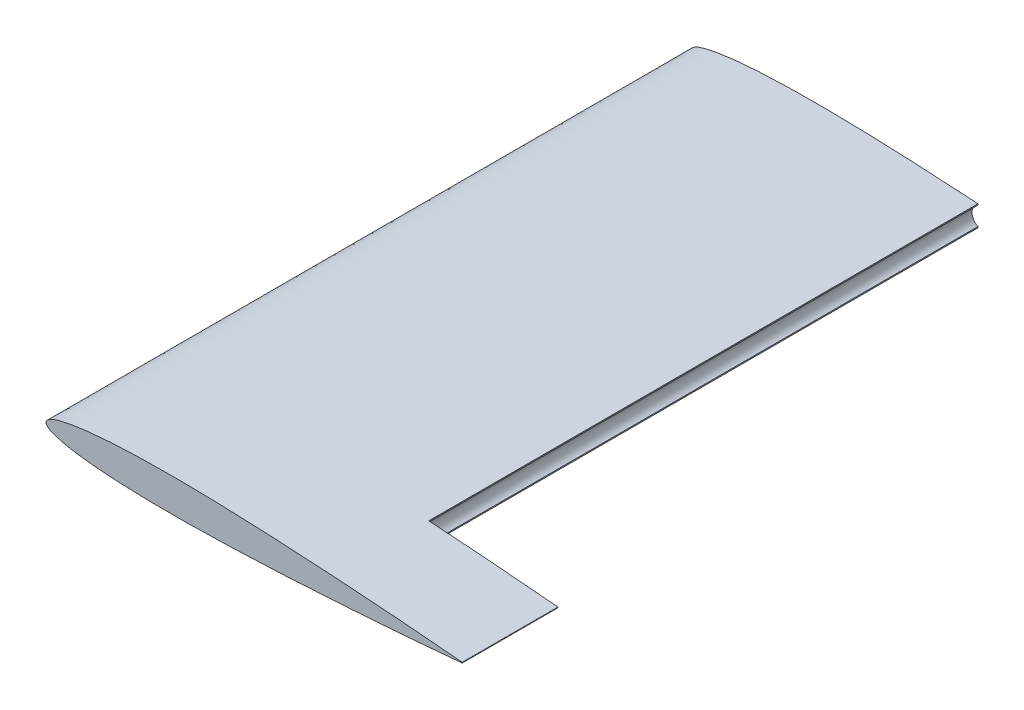
from build123d import *

# Parameters (mm, degrees)
CORPOFOAM_DEPTH             = 132
FOAMLATERALE_DEPTH          = 23
SCHIZZO2_R                  = 3
FOROLONGHERONE_DEPTH        = 185.547595795
SCHIZZO6_W                  = 3
SCHIZZO6_H                  = 5.01489576
SMUSSOPOSTERIORE_DEPTH      = 132
SCHIZZO8_R                  = 1.5
FOROPERNO_DEPTH             = 185.547595795
SCHIZZO9_R                  = 3
SCHIZZO9_R_2                = 1.5
CHIUSURAFORITERMINALI_DEPTH = 5
SCHIZZO10_R                 = 1.75
FOROVITE_DEPTH              = 13
TAGLIODADO_DEPTH            = 3


with BuildPart() as part:
    # Schizzo1 → CorpoFoam (new body)
    with BuildSketch(Plane.XY):
        with BuildLine():
            ThreePointArc((70, -2.443), (67.557, 0), (70, 2.443))
            add(Edge.make_bspline(
                [(70, 2.443), (66.667669045, 2.659279734), (60.003104625, 3.061747723), (50.003008601, 3.552139212), (40.002598558, 3.902946494), (31.666961486, 4.025260151), (24.9991546, 3.976933791), (19.997775587, 3.844976398), (14.993363131, 3.592486959), (10.827184065, 3.237651579), (7.489054388, 2.814021367), (4.99359465, 2.403673059), (2.84962634, 1.867925494), (1.165413503, 1.320987252), (-0.664613784, 0), (1.165413503, -1.320987252), (2.84962634, -1.867925494), (4.99359465, -2.403673059), (7.489054388, -2.814021367), (10.827184065, -3.237651579), (14.993363131, -3.592486959), (19.997775587, -3.844976398), (24.9991546, -3.976933791), (31.666961486, -4.025260151), (40.002598558, -3.902946494), (50.003008601, -3.552139212), (60.003104625, -3.061747723), (66.667669045, -2.659279734), (70, -2.443)],
                knots=[0.149112224, 0.149112224, 0.149112224, 0.149112224, 0.198750974, 0.248359097, 0.29793737, 0.347491327, 0.37226694, 0.397050924, 0.421859475, 0.446731346, 0.459220451, 0.471790602, 0.484560454, 0.491195112, 0.5, 0.508804888, 0.515439546, 0.528209398, 0.540779549, 0.553268654, 0.578140525, 0.602949076, 0.62773306, 0.652508673, 0.70206263, 0.751640903, 0.801249026, 0.850887776, 0.850887776, 0.850887776, 0.850887776], degree=3))
        make_face()
    extrude(amount=CORPOFOAM_DEPTH)

    # Schizzo7 → FoamLaterale (add)
    with BuildSketch(Plane.XY.offset(132)):
        with BuildLine():
            ThreePointArc((100, 0.084), (100.084, 0), (100, -0.084))
            add(Edge.make_bspline(
                [(100, 0.084), (98.333488815, 0.23674648), (95.001194725, 0.542172689), (88.335559621, 1.11089898), (80.003293356, 1.763610995), (70.002998933, 2.457861693), (60.003104625, 3.061747723), (50.003008601, 3.552139212), (40.002598558, 3.902946494), (31.666961486, 4.025260151), (24.9991546, 3.976933791), (19.997775587, 3.844976398), (14.993363131, 3.592486959), (10.827184065, 3.237651579), (7.489054388, 2.814021367), (4.99359465, 2.403673059), (2.84962634, 1.867925494), (1.165413503, 1.320987252), (-0.664613784, 0), (1.165413503, -1.320987252), (2.84962634, -1.867925494), (4.99359465, -2.403673059), (7.489054388, -2.814021367), (10.827184065, -3.237651579), (14.993363131, -3.592486959), (19.997775587, -3.844976398), (24.9991546, -3.976933791), (31.666961486, -4.025260151), (40.002598558, -3.902946494), (50.003008601, -3.552139212), (60.003104625, -3.061747723), (70.002998933, -2.457861693), (80.003293356, -1.763610995), (88.335559621, -1.11089898), (95.001194725, -0.542172689), (98.333488815, -0.23674648), (100, -0.084)],
                knots=[0, 0, 0, 0, 0.024876293, 0.049741715, 0.099443402, 0.149112224, 0.198750974, 0.248359097, 0.29793737, 0.347491327, 0.37226694, 0.397050924, 0.421859475, 0.446731346, 0.459220451, 0.471790602, 0.484560454, 0.491195112, 0.5, 0.508804888, 0.515439546, 0.528209398, 0.540779549, 0.553268654, 0.578140525, 0.602949076, 0.62773306, 0.652508673, 0.70206263, 0.751640903, 0.801249026, 0.850887776, 0.900556598, 0.950258285, 0.975123707, 1, 1, 1, 1], degree=3))
        make_face()
    extrude(amount=FOAMLATERALE_DEPTH)

    # Schizzo2 → ForoLongherone (cut, through all)
    with BuildSketch(Plane.XY.offset(155)):
        with Locations((25, 0)):
            Circle(SCHIZZO2_R)
    extrude(amount=-FOROLONGHERONE_DEPTH, mode=Mode.SUBTRACT)

    # Schizzo6 → SmussoPosteriore (cut)
    with BuildSketch(Plane(origin=(0, 0, 0), x_dir=(-1, 0, 0), z_dir=(0, 0, -1))):
        with Locations((-70.5, 0)):
            Rectangle(SCHIZZO6_W, SCHIZZO6_H)
    extrude(amount=-SMUSSOPOSTERIORE_DEPTH, mode=Mode.SUBTRACT)

    # Schizzo8 → ForoPerno (cut, through all)
    with BuildSketch(Plane.XY.offset(155)):
        with Locations((71, 0)):
            Circle(SCHIZZO8_R)
    extrude(amount=-FOROPERNO_DEPTH, mode=Mode.SUBTRACT)

    # Schizzo9 → ChiusuraForiTerminali (add)
    with BuildSketch(Plane.XY.offset(155)):
        with Locations((25, 0)):
            Circle(SCHIZZO9_R)
        with Locations((71, 0)):
            Circle(SCHIZZO9_R_2)
    extrude(amount=-CHIUSURAFORITERMINALI_DEPTH)

    # Schizzo10 → ForoVite (cut)
    with BuildSketch(Plane(origin=(0, 0, 0), x_dir=(-1, 0, 0), z_dir=(0, 0, -1))):
        with Locations((-34.75, 0)):
            Circle(SCHIZZO10_R)
    extrude(amount=-FOROVITE_DEPTH, mode=Mode.SUBTRACT)

    # Schizzo11 → TaglioDado (cut)
    with BuildSketch(Plane.XY.offset(6)):
        Polygon((31.25, 0), (31.25, -7.246651295), (38.25, -7.246651295), (38.25, 0), (36.5, 3.031088913), (33, 3.031088913), align=None)
    extrude(amount=TAGLIODADO_DEPTH, mode=Mode.SUBTRACT)


solid = part.part
